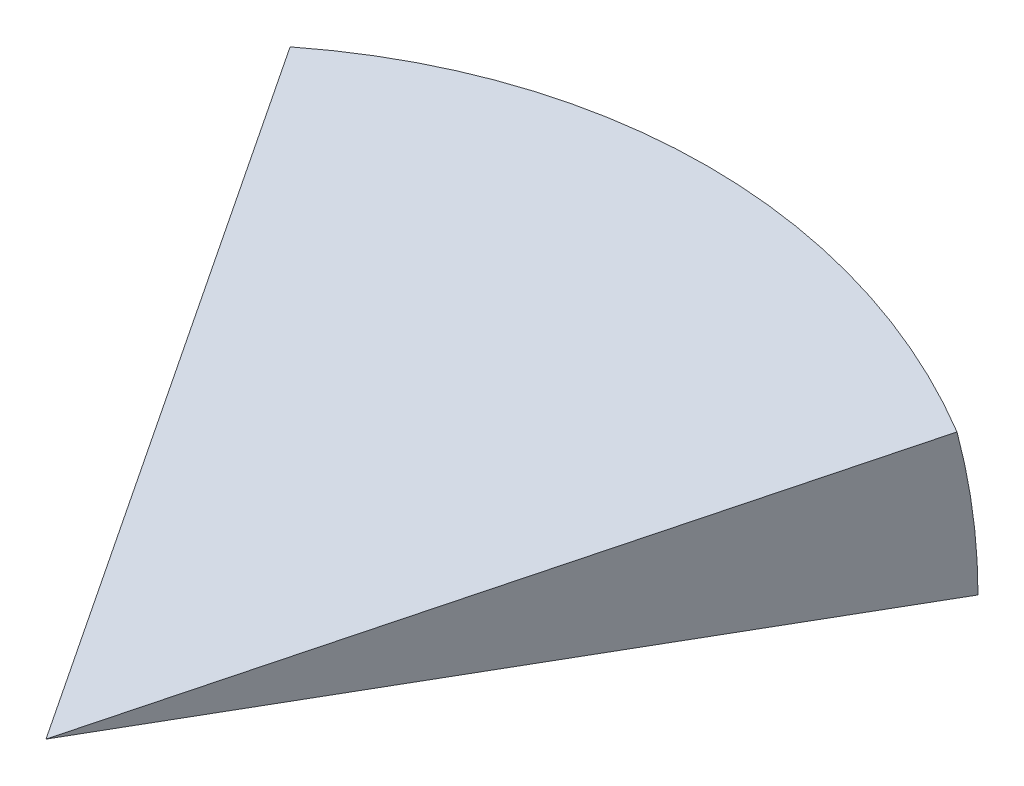
from build123d import *

# Parameters (mm, degrees)
REVOLVE_2_ANGLE     = 14
SKETCH_5_W          = 44.686573774
SKETCH_5_H          = 93.829393492
CUT_EXTRUDE_1_DEPTH = 50
SKETCH_6_W          = 25.08892812
SKETCH_6_H          = 77.533839386
CUT_EXTRUDE_2_DEPTH = 39


with BuildPart() as part:
    # 草图3 → 旋转2 (revolve)
    with BuildSketch(Plane(origin=(0, 0, 0), x_dir=(1, 0, 0), z_dir=(0, 1, 0))):
        with BuildLine():
            Line((-30, 0), (30, 0))
            ThreePointArc((30, 0), (0, 30), (-30, 0))
        make_face()
    revolve(axis=Axis((-30, 0, 0), (1, 0, 0)), revolution_arc=REVOLVE_2_ANGLE)

    # 草图5 → 切除-拉伸1 (cut)
    with BuildSketch(Plane(origin=(0, 0, 0), x_dir=(0, 1, 0), z_dir=(-0.8660254037844416, 0, -0.49999999999999495))):
        Rectangle(SKETCH_5_W, SKETCH_5_H)
    extrude(amount=-CUT_EXTRUDE_1_DEPTH, mode=Mode.SUBTRACT)

    # 草图6 → 切除-拉伸2 (cut)
    with BuildSketch(Plane(origin=(0, 0, 0), x_dir=(0, 1, 0), z_dir=(-0.8660254037844416, 0, 0.49999999999999495))):
        Rectangle(SKETCH_6_W, SKETCH_6_H)
    extrude(amount=CUT_EXTRUDE_2_DEPTH, mode=Mode.SUBTRACT)


solid = part.part
